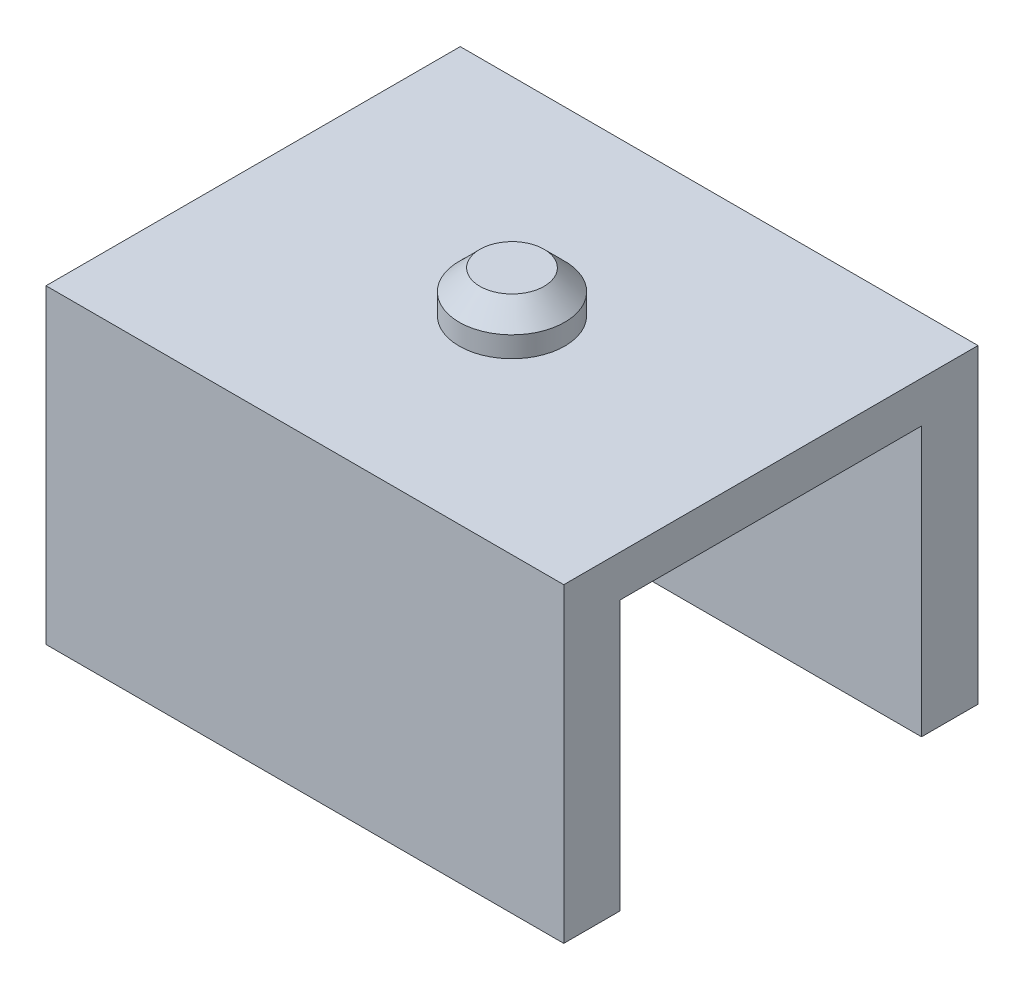
from build123d import *

# Parameters (mm, degrees)
SKETCH1_W           = 25
SKETCH1_H           = 15
BOSS_EXTRUDE1_DEPTH = 20
SKETCH2_W           = 25
SKETCH2_H           = 14.55
CUT_EXTRUDE1_DEPTH  = 13
SKETCH4_R           = 2.55
BOSS_EXTRUDE2_DEPTH = 2
CHAMFER1_SIZE       = 1


with BuildPart() as part:
    # Sketch1 → Boss-Extrude1 (new body)
    with BuildSketch(Plane.XY):
        with Locations((12.5, 7.5)):
            Rectangle(SKETCH1_W, SKETCH1_H)
    extrude(amount=BOSS_EXTRUDE1_DEPTH)

    # Sketch2 → Cut-Extrude1 (cut)
    with BuildSketch(Plane.XZ):
        with Locations((12.5, 10)):
            Rectangle(SKETCH2_W, SKETCH2_H)
    extrude(amount=-CUT_EXTRUDE1_DEPTH, mode=Mode.SUBTRACT)

    # Sketch4 → Boss-Extrude2 (add)
    with BuildSketch(Plane(origin=(0, 15, 0), x_dir=(1, 0, 0), z_dir=(0, 1, 0))):
        with Locations(Location((12.5, -10, 0), (0, 0, 270))):
            Circle(SKETCH4_R)
    extrude(amount=BOSS_EXTRUDE2_DEPTH)

    # Chamfer1
    chamfer1_edges = [part.edges().sort_by_distance(p)[0] for p in [
        (12.5, 17, 7.45),
    ]]
    chamfer(chamfer1_edges, length=CHAMFER1_SIZE)


solid = part.part
